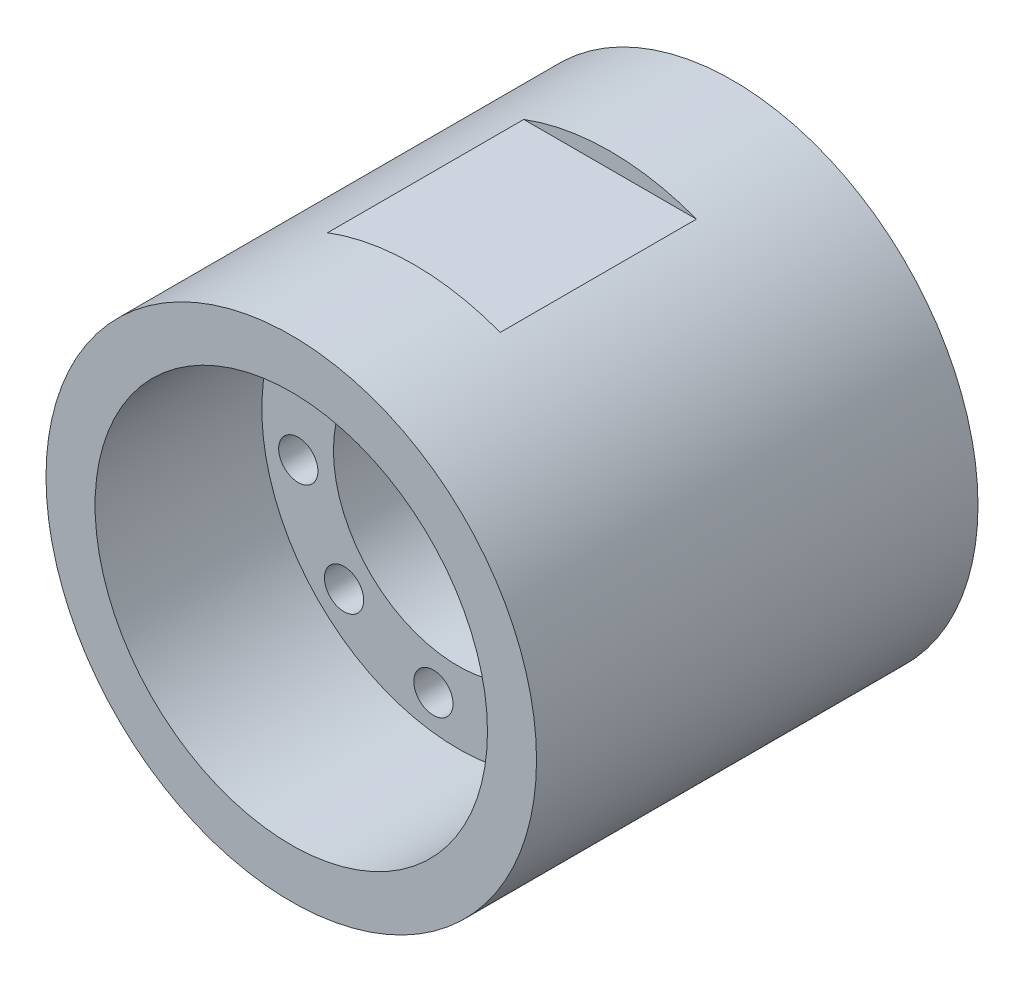
from build123d import *

# Parameters (mm, degrees)
SKETCH1_R           = 25
BOSS_EXTRUDE1_DEPTH = 45
SKETCH2_R           = 20
CUT_EXTRUDE1_DEPTH  = 17
SKETCH3_R           = 12.7
CUT_EXTRUDE2_DEPTH  = 18
SKETCH4_R           = 2
CUT_EXTRUDE3_DEPTH  = 46.099889135
CIRPATTERN1_COUNT   = 10
CUT_EXTRUDE4_START  = -20
SKETCH5_R           = 20
CUT_EXTRUDE4_DEPTH  = 20
CUT_EXTRUDE8_DEPTH  = 10


with BuildPart() as part:
    # Sketch1 → Boss-Extrude1 (new body)
    with BuildSketch(Plane.XY):
        with Locations(Location((0, 0, 0), (0, 0, 180))):
            Circle(SKETCH1_R)
    extrude(amount=BOSS_EXTRUDE1_DEPTH)

    # Sketch2 → Cut-Extrude1 (cut)
    with BuildSketch(Plane.XY.offset(45)):
        Circle(SKETCH2_R)
    extrude(amount=-CUT_EXTRUDE1_DEPTH, mode=Mode.SUBTRACT)

    # Sketch3 → Cut-Extrude2 (cut)
    with BuildSketch(Plane.XY.offset(28)):
        Circle(SKETCH3_R)
    extrude(amount=-CUT_EXTRUDE2_DEPTH, mode=Mode.SUBTRACT)

    # Sketch4 → Cut-Extrude3 (cut, through all)
    with BuildSketch(Plane.XY.offset(28)):
        with Locations((-7.552723676, 14.669913602)):
            Circle(SKETCH4_R)
    cut_extrude3 = extrude(amount=-CUT_EXTRUDE3_DEPTH, mode=Mode.SUBTRACT)

    # CirPattern1: Cut-Extrude3 ×10 about axis
    cirpattern1_axis = Axis((0, 0, 0), (0, 0, 1))
    for i in range(1, CIRPATTERN1_COUNT):
        add(cut_extrude3.rotate(cirpattern1_axis, i * 360 / CIRPATTERN1_COUNT), mode=Mode.SUBTRACT)

    # Sketch5 → Cut-Extrude4 (cut)
    with BuildSketch(Plane(origin=(0, 0, 0), x_dir=(-1, 0, 0), z_dir=(0, 0, -1)).offset(CUT_EXTRUDE4_START)):
        with Locations(Location((0, 0, 0), (0, 0, 180))):
            Circle(SKETCH5_R)
    extrude(amount=CUT_EXTRUDE4_DEPTH, mode=Mode.SUBTRACT)

    # Sketch8 → Cut-Extrude8 (cut, symmetric)
    with BuildSketch(Plane.XY.offset(22.5)):
        with BuildLine():
            Line((-8.8, 23.4), (8.8, 23.4))
            ThreePointArc((8.8, 23.4), (0, 25), (-8.8, 23.4))
        make_face()
        with BuildLine():
            Line((-8.8, -23.4), (8.8, -23.4))
            ThreePointArc((8.8, -23.4), (0, -25), (-8.8, -23.4))
        make_face()
    extrude(amount=CUT_EXTRUDE8_DEPTH, both=True, mode=Mode.SUBTRACT)


solid = part.part
